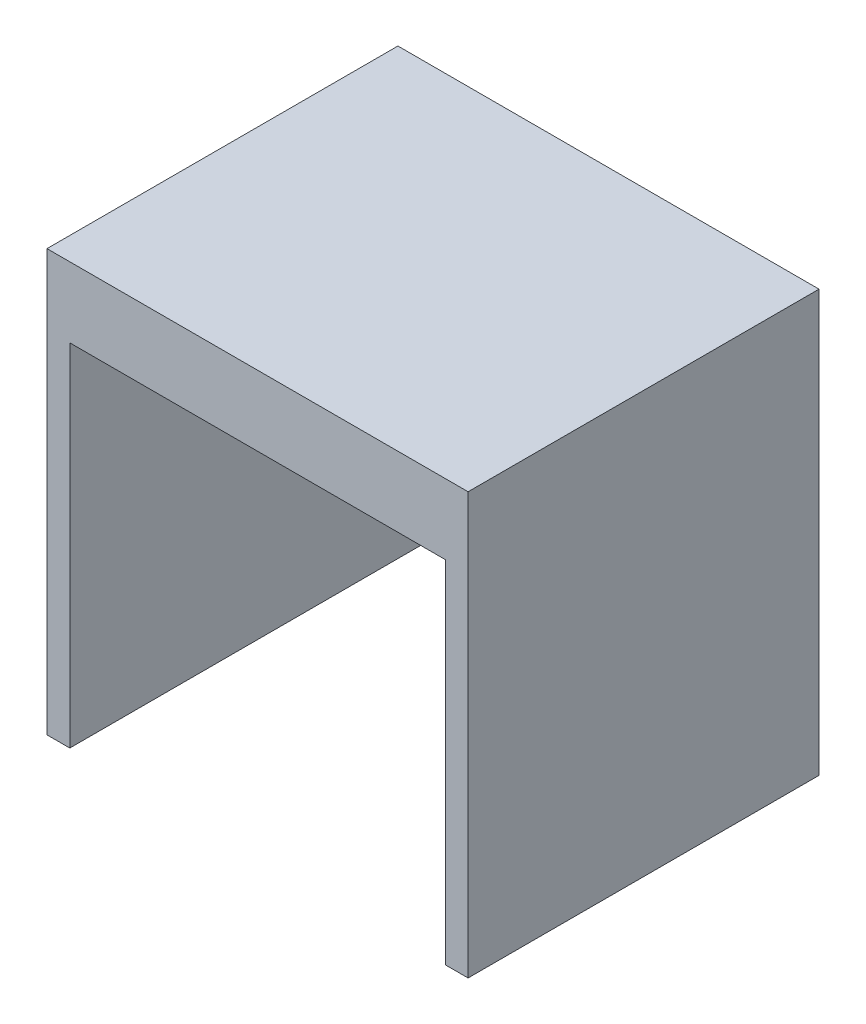
from build123d import *

# Parameters (mm, degrees)
SKETCH1_W           = 120
SKETCH1_H           = 100
BOSS_EXTRUDE1_DEPTH = 120
SKETCH2_W           = 107
SKETCH2_H           = 120
CUT_EXTRUDE1_DEPTH  = 100
SKETCH4_W           = 85
SKETCH4_H           = 13
CUT_EXTRUDE2_DEPTH  = 95
CUT_EXTRUDE3_START  = -50
SKETCH5_W           = 79.569660058
SKETCH5_H           = 2.731854476
CUT_EXTRUDE3_DEPTH  = 40


with BuildPart() as part:
    # Sketch1 → Boss-Extrude1 (new body)
    with BuildSketch(Plane(origin=(0, 0, 0), x_dir=(1, 0, 0), z_dir=(0, 1, 0))):
        Rectangle(SKETCH1_W, SKETCH1_H)
    extrude(amount=BOSS_EXTRUDE1_DEPTH)

    # Sketch2 → Cut-Extrude1 (cut)
    with BuildSketch(Plane.XZ):
        Rectangle(SKETCH2_W, SKETCH2_H)
    extrude(amount=-CUT_EXTRUDE1_DEPTH, mode=Mode.SUBTRACT)

    # Sketch4 → Cut-Extrude2 (cut)
    with BuildSketch(Plane(origin=(0, 0, -50), x_dir=(-1, 0, 0), z_dir=(0, 0, -1))):
        with Locations((3.915635034, 109.231854476)):
            Rectangle(SKETCH4_W, SKETCH4_H)
    extrude(amount=-CUT_EXTRUDE2_DEPTH, mode=Mode.SUBTRACT)

    # Sketch5 → Cut-Extrude3 (cut)
    with BuildSketch(Plane(origin=(0, 0, -50), x_dir=(-1, 0, 0), z_dir=(0, 0, -1)).offset(CUT_EXTRUDE3_START)):
        with Locations((2.947024447, 101.365927238)):
            Rectangle(SKETCH5_W, SKETCH5_H)
    extrude(amount=-CUT_EXTRUDE3_DEPTH, mode=Mode.SUBTRACT)


solid = part.part
